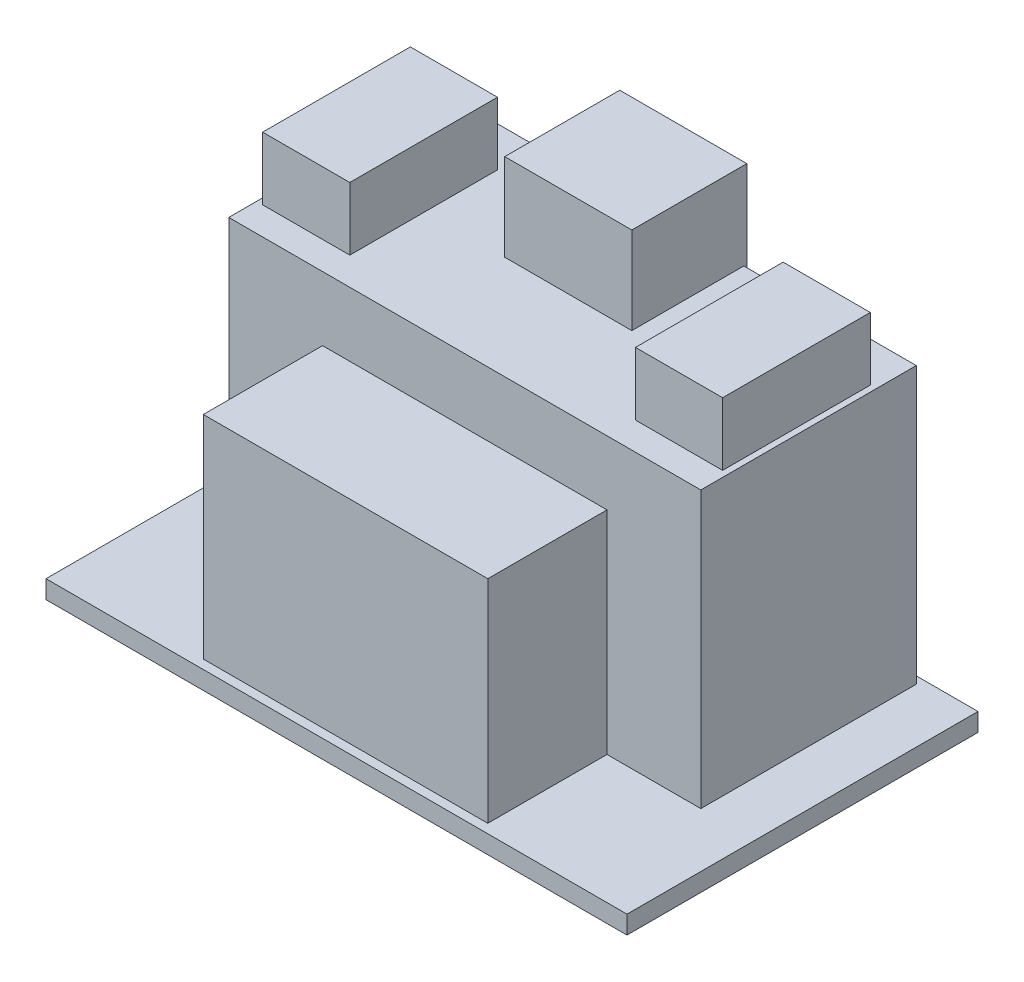
from build123d import *

# Parameters (mm, degrees)
SKETCH_1_W      = 480
SKETCH_1_H      = 290
EXTRUDE_1_DEPTH = 15
SKETCH_2_W      = 390
SKETCH_2_H      = 178
EXTRUDE_2_DEPTH = 228
SKETCH_3_W      = 235
SKETCH_3_H      = 105
EXTRUDE_3_DEPTH = 175
SKETCH_4_W      = 105
SKETCH_4_H      = 95
EXTRUDE_4_DEPTH = 300
SKETCH_5_W      = 72
SKETCH_5_H      = 122
EXTRUDE_5_DEPTH = 280
SKETCH_6_W      = 72
SKETCH_6_H      = 122
EXTRUDE_6_DEPTH = 280


with BuildPart() as part:
    # 草图1 → 凸台-拉伸1 (new body)
    with BuildSketch(Plane(origin=(0, 0, 0), x_dir=(1, 0, 0), z_dir=(0, 1, 0))):
        Rectangle(SKETCH_1_W, SKETCH_1_H)
    extrude(amount=-EXTRUDE_1_DEPTH)

    # 草图2 → 凸台-拉伸2 (add)
    with BuildSketch(Plane(origin=(0, 0, 0), x_dir=(1, 0, 0), z_dir=(0, 1, 0))):
        with Locations((0, 50)):
            Rectangle(SKETCH_2_W, SKETCH_2_H)
    extrude(amount=EXTRUDE_2_DEPTH)

    # 草图3 → 凸台-拉伸3 (add)
    with BuildSketch(Plane(origin=(0, 0, 0), x_dir=(1, 0, 0), z_dir=(0, 1, 0))):
        with Locations((0, -85)):
            Rectangle(SKETCH_3_W, SKETCH_3_H)
    extrude(amount=EXTRUDE_3_DEPTH)

    # 草图4 → 凸台-拉伸4 (add)
    with BuildSketch(Plane(origin=(0, 0, 0), x_dir=(1, 0, 0), z_dir=(0, 1, 0))):
        with Locations((0, 94)):
            Rectangle(SKETCH_4_W, SKETCH_4_H)
    extrude(amount=EXTRUDE_4_DEPTH)

    # 草图5 → 凸台-拉伸5 (add)
    with BuildSketch(Plane(origin=(0, 0, 0), x_dir=(1, 0, 0), z_dir=(0, 1, 0))):
        with Locations((-154, 45)):
            Rectangle(SKETCH_5_W, SKETCH_5_H)
    extrude(amount=EXTRUDE_5_DEPTH)

    # 草图6 → 凸台-拉伸6 (add)
    with BuildSketch(Plane(origin=(0, 0, 0), x_dir=(1, 0, 0), z_dir=(0, 1, 0))):
        with Locations((154, 45)):
            Rectangle(SKETCH_6_W, SKETCH_6_H)
    extrude(amount=EXTRUDE_6_DEPTH)


solid = part.part
